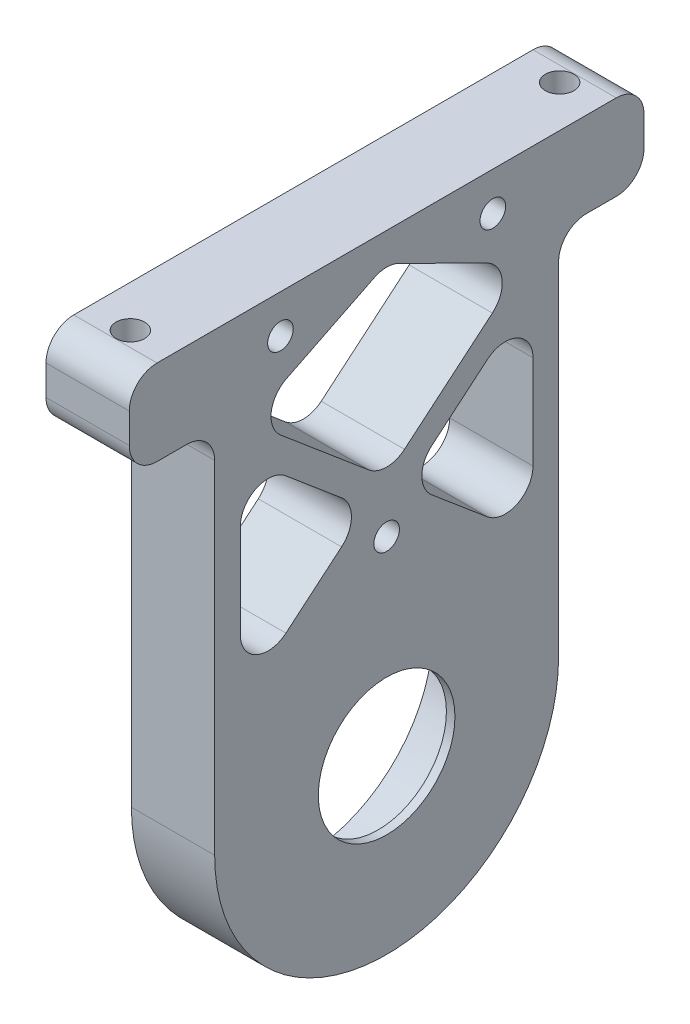
from build123d import *

# Parameters (mm, degrees)
SKETCH1_R           = 1.5
BOSS_EXTRUDE1_DEPTH = 9.75
SKETCH3_R           = 1.675
CUT_EXTRUDE1_DEPTH  = 10
CUT_EXTRUDE2_REACH  = 64.002
SKETCH1_4_R         = 8
FILLET1_R           = 3.25
SKETCH1_5_R         = 15.1375
SKETCH1_5_R_2       = 8
CUT_EXTRUDE3_DEPTH  = 8.75


with BuildPart() as part:
    # Sketch1 → Boss-Extrude1 (new body)
    with BuildSketch(Plane(origin=(0, 0, 0), x_dir=(0, 0, -1), z_dir=(1, 0, 0))):
        with BuildLine():
            Line((20.1375, 0), (20.1375, 43.3))
            Line((20.1375, 43.3), (30.1375, 43.3))
            Line((30.1375, 43.3), (30.1375, 53.3))
            Line((30.1375, 53.3), (-30.1375, 53.3))
            Line((-30.1375, 53.3), (-30.1375, 43.3))
            Line((-30.1375, 43.3), (-20.1375, 43.3))
            Line((-20.1375, 43.3), (-20.1375, 0))
            ThreePointArc((-20.1375, 0), (0, -20.1375), (20.1375, 0))
        make_face()
        Polygon((-17.1375, 38.810813136), (-2.327943822, 26.332666354), (-17.1375, 13.854519572), align=None, mode=Mode.SUBTRACT)
        with Locations((-12.43443714, 48.8)):
            Circle(SKETCH1_R, mode=Mode.SUBTRACT)
        with Locations((0, 22.254350724)):
            Circle(SKETCH1_R, mode=Mode.SUBTRACT)
        Polygon((2.327943822, 26.332666354), (17.1375, 38.810813136), (17.1375, 13.854519572), align=None, mode=Mode.SUBTRACT)
        Polygon((0, 28.294131259), (-16.171581688, 41.919885304), (0, 49.950465907), (16.171581688, 41.919885304), align=None, mode=Mode.SUBTRACT)
        with Locations((12.43443714, 48.8)):
            Circle(SKETCH1_R, mode=Mode.SUBTRACT)
    extrude(amount=BOSS_EXTRUDE1_DEPTH)

    # Sketch3 → Cut-Extrude1 (cut)
    with BuildSketch(Plane(origin=(0, 53.3, 0), x_dir=(1, 0, 0), z_dir=(0, 1, 0))):
        with Locations(Location((4.875, 25.1375, 0), (0, 0, 270))):
            Circle(SKETCH3_R)
        with Locations(Location((4.875, -25.1375, 0), (0, 0, 90))):
            Circle(SKETCH3_R)
    extrude(amount=-CUT_EXTRUDE1_DEPTH, mode=Mode.SUBTRACT)

    # Sketch1<4> → Cut-Extrude2 (cut, up to next)
    with BuildSketch(Plane(origin=(0, 0, 0), x_dir=(0, 0, -1), z_dir=(1, 0, 0)), mode=Mode.PRIVATE) as cut_extrude2_sk1:
        Circle(SKETCH1_4_R)
    cut_extrude2_tool1 = extrude(cut_extrude2_sk1.sketch, amount=CUT_EXTRUDE2_REACH, mode=Mode.PRIVATE) & part.part
    add(cut_extrude2_tool1.solids().sort_by_distance((0, 0, 0))[0], mode=Mode.SUBTRACT)

    # Fillet1
    fillet1_edges = [part.edges().sort_by_distance(p)[0] for p in [
        (4.875, 41.919885304, -16.171581688),
        (4.875, 49.950465907, 0),
        (4.875, 41.919885304, 16.171581688),
        (4.875, 28.294131259, 0),
        (4.875, 38.810813136, 17.1375),
        (4.875, 13.854519572, 17.1375),
        (4.875, 26.332666354, 2.327943822),
        (4.875, 53.3, -30.1375),
        (4.875, 43.3, -30.1375),
        (4.875, 43.3, -20.1375),
        (4.875, 43.3, 20.1375),
        (4.875, 43.3, 30.1375),
        (4.875, 53.3, 30.1375),
        (4.875, 13.854519572, -17.1375),
        (4.875, 38.810813136, -17.1375),
        (4.875, 26.332666354, -2.327943822),
    ]]
    fillet(fillet1_edges, radius=FILLET1_R)

    # Sketch1<5> → Cut-Extrude3 (cut)
    with BuildSketch(Plane(origin=(0, 0, 0), x_dir=(0, 0, -1), z_dir=(1, 0, 0))):
        with Locations(Location((0, 0, 0), (0, 0, 180))):
            Circle(SKETCH1_5_R)
        Circle(SKETCH1_5_R_2, mode=Mode.SUBTRACT)
    extrude(amount=CUT_EXTRUDE3_DEPTH, mode=Mode.SUBTRACT)


solid = part.part
